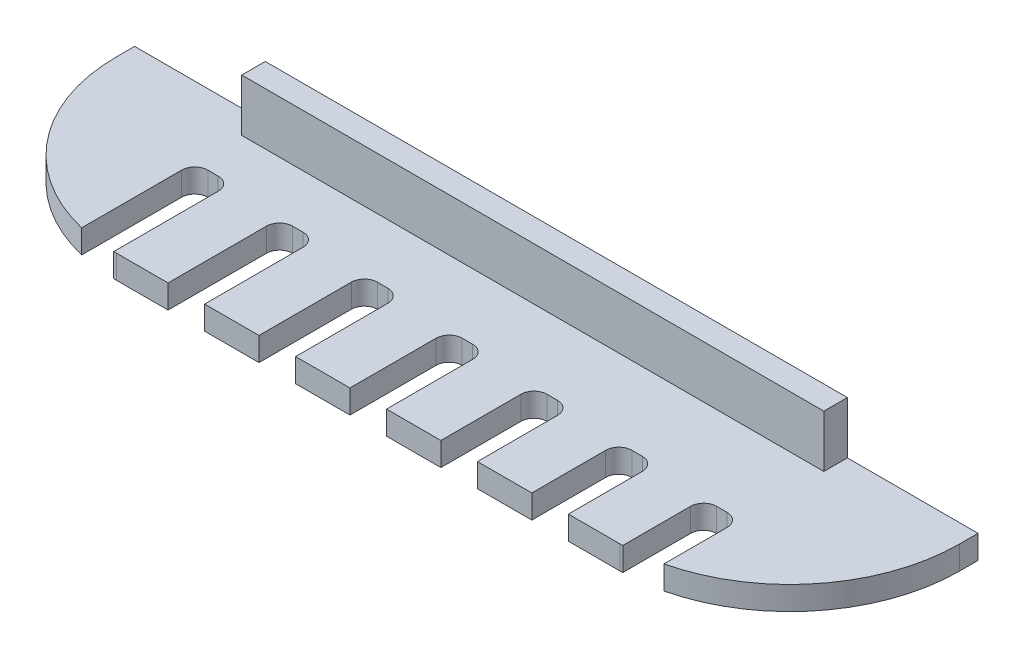
from build123d import *

# Parameters (mm, degrees)
BOSS_EXTRUDE1_DEPTH = 1.8
SKETCH4_W           = 44.55
SKETCH4_H           = 1.8
BOSS_EXTRUDE2_DEPTH = 4


with BuildPart() as part:
    # Sketch2 → Boss-Extrude1 (new body)
    with BuildSketch(Plane(origin=(0, 0, 0), x_dir=(1, 0, 0), z_dir=(0, 1, 0))):
        with BuildLine():
            Line((-32.275, 7.2), (32.275, 7.2))
            Line((32.275, 7.2), (32.275, 5.8))
            ThreePointArc((32.275, 5.8), (29.476225417, -2.258225611), (22.285, -6.846734756))
            Line((22.285, -6.846734756), (22.285, -2.012121212))
            ThreePointArc((22.285, -2.012121212), (21.992106781, -1.305014431), (21.285, -1.012121212))
            Line((21.285, -1.012121212), (20.485, -1.012121212))
            ThreePointArc((20.485, -1.012121212), (19.777893219, -1.305014431), (19.485, -2.012121212))
            Line((19.485, -2.012121212), (19.485, -7.198303735))
            ThreePointArc((19.485, -7.198303735), (19.380003425, -7.199575927), (19.275, -7.2))
            Line((19.275, -7.2), (15.325, -7.2))
            Line((15.325, -7.2), (15.325, -1.543434343))
            ThreePointArc((15.325, -1.543434343), (15.032106781, -0.836327562), (14.325, -0.543434343))
            Line((14.325, -0.543434343), (13.525, -0.543434343))
            ThreePointArc((13.525, -0.543434343), (12.817893219, -0.836327562), (12.525, -1.543434343))
            Line((12.525, -1.543434343), (12.525, -7.2))
            Line((12.525, -7.2), (8.365, -7.2))
            Line((8.365, -7.2), (8.365, -1.074747475))
            ThreePointArc((8.365, -1.074747475), (8.072106781, -0.367640694), (7.365, -0.074747475))
            Line((7.365, -0.074747475), (6.565, -0.074747475))
            ThreePointArc((6.565, -0.074747475), (5.857893219, -0.367640694), (5.565, -1.074747475))
            Line((5.565, -1.074747475), (5.565, -7.2))
            Line((5.565, -7.2), (1.405, -7.2))
            Line((1.405, -7.2), (1.405, -0.606060606))
            ThreePointArc((1.405, -0.606060606), (1.112106781, 0.101046175), (0.405, 0.393939394))
            Line((0.405, 0.393939394), (-0.395, 0.393939394))
            ThreePointArc((-0.395, 0.393939394), (-1.102106781, 0.101046175), (-1.395, -0.606060606))
            Line((-1.395, -0.606060606), (-1.395, -7.2))
            Line((-1.395, -7.2), (-5.555, -7.2))
            Line((-5.555, -7.2), (-5.555, -0.137373737))
            ThreePointArc((-5.555, -0.137373737), (-5.847893219, 0.569733044), (-6.555, 0.862626263))
            Line((-6.555, 0.862626263), (-7.355, 0.862626263))
            ThreePointArc((-7.355, 0.862626263), (-8.062106781, 0.569733044), (-8.355, -0.137373737))
            Line((-8.355, -0.137373737), (-8.355, -7.2))
            Line((-8.355, -7.2), (-12.515, -7.2))
            Line((-12.515, -7.2), (-12.515, 0.331313131))
            ThreePointArc((-12.515, 0.331313131), (-12.807893219, 1.038419912), (-13.515, 1.331313131))
            Line((-13.515, 1.331313131), (-14.315, 1.331313131))
            ThreePointArc((-14.315, 1.331313131), (-15.022106781, 1.038419912), (-15.315, 0.331313131))
            Line((-15.315, 0.331313131), (-15.315, -7.2))
            Line((-15.315, -7.2), (-19.275, -7.2))
            ThreePointArc((-19.275, -7.2), (-19.375002959, -7.199615356), (-19.475, -7.198461447))
            Line((-19.475, -7.198461447), (-19.475, 0.8))
            ThreePointArc((-19.475, 0.8), (-19.767893219, 1.507106781), (-20.475, 1.8))
            Line((-20.475, 1.8), (-21.275, 1.8))
            ThreePointArc((-21.275, 1.8), (-21.982106781, 1.507106781), (-22.275, 0.8))
            Line((-22.275, 0.8), (-22.275, -6.849110641))
            ThreePointArc((-22.275, -6.849110641), (-29.473039027, -2.262257748), (-32.275, 5.8))
            Line((-32.275, 5.8), (-32.275, 7.2))
        make_face()
    extrude(amount=BOSS_EXTRUDE1_DEPTH)

    # Sketch4 → Boss-Extrude2 (add)
    with BuildSketch(Plane(origin=(0, 1.8, 0), x_dir=(1, 0, 0), z_dir=(0, 1, 0))):
        with Locations((0, 6.3)):
            Rectangle(SKETCH4_W, SKETCH4_H)
    extrude(amount=BOSS_EXTRUDE2_DEPTH)


solid = part.part
